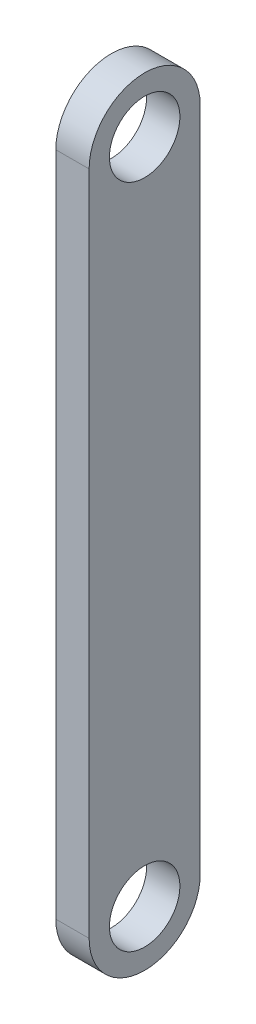
from build123d import *

# Parameters (mm, degrees)
SKETCH3_W           = 10
SKETCH3_H           = 70
BOSS_EXTRUDE1_DEPTH = 3
SKETCH4_R           = 3.175
CUT_EXTRUDE1_DEPTH  = 5
FILLET2_RADIUS      = 5
FILLET2_LENGTH      = 3
FILLET3_RADIUS      = 5
FILLET3_LENGTH      = 3


with BuildPart() as part:
    # Sketch3 → Boss-Extrude1 (new body)
    with BuildSketch(Plane(origin=(0, 0, 0), x_dir=(0, 0, -1), z_dir=(1, 0, 0))):
        Rectangle(SKETCH3_W, SKETCH3_H)
    extrude(amount=BOSS_EXTRUDE1_DEPTH)

    # Sketch4 → Cut-Extrude1 (cut)
    with BuildSketch(Plane(origin=(3, 0, 0), x_dir=(0, 0, -1), z_dir=(1, 0, 0))):
        with Locations((0, 30)):
            Circle(SKETCH4_R)
        with Locations((0, -30)):
            Circle(SKETCH4_R)
    extrude(amount=-CUT_EXTRUDE1_DEPTH, mode=Mode.SUBTRACT)

    # Fillet2: full round fillet: the end face becomes a half cylinder, R = half its width
    fillet2_face = Plane((1.5, 35, 0), x_dir=(-1, 0, 0), z_dir=(0, 1, 0))  # on the end face: x along it, z out of the body
    fillet2_slab = fillet2_face.offset(-FILLET2_RADIUS / 2) * Box(FILLET2_LENGTH, 2 * FILLET2_RADIUS, FILLET2_RADIUS, mode=Mode.PRIVATE)  # the body's end, R deep
    fillet2_round = Plane((1.5, 30, 0), x_dir=(0, 1, 0), z_dir=(-1, 0, 0)) * Cylinder(FILLET2_RADIUS, FILLET2_LENGTH, mode=Mode.PRIVATE)  # its axis R under the face
    add(fillet2_slab - fillet2_round, mode=Mode.SUBTRACT)

    # Fillet3: full round fillet: the end face becomes a half cylinder, R = half its width
    fillet3_face = Plane((1.5, -35, 0), x_dir=(-1, 0, 0), z_dir=(0, -1, 0))  # on the end face: x along it, z out of the body
    fillet3_slab = fillet3_face.offset(-FILLET3_RADIUS / 2) * Box(FILLET3_LENGTH, 2 * FILLET3_RADIUS, FILLET3_RADIUS, mode=Mode.PRIVATE)  # the body's end, R deep
    fillet3_round = Plane((1.5, -30, 0), x_dir=(0, -1, 0), z_dir=(-1, 0, 0)) * Cylinder(FILLET3_RADIUS, FILLET3_LENGTH, mode=Mode.PRIVATE)  # its axis R under the face
    add(fillet3_slab - fillet3_round, mode=Mode.SUBTRACT)


solid = part.part
